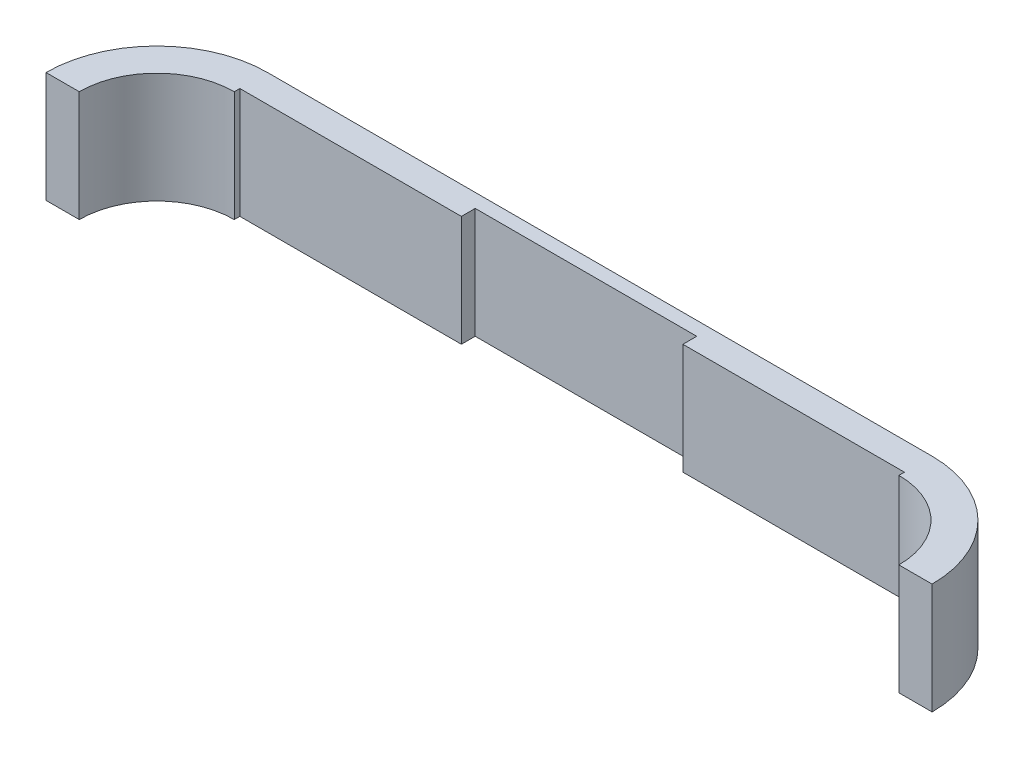
from build123d import *

# Parameters (mm, degrees)
BOSS_EXTRUDE3_DEPTH = 2000


with BuildPart() as part:
    # Sketch1 → Boss-Extrude3 (new body)
    with BuildSketch(Plane(origin=(0, 0, 0), x_dir=(1, 0, 0), z_dir=(0, 1, 0))):
        with BuildLine():
            Line((4435.152503865, -5133.846248201), (16435.152503865, -5133.846248201))
            ThreePointArc((16435.152503865, -5133.846248201), (17849.366066238, -5719.632685828), (18435.152503865, -7133.846248201))
            Line((18435.152503865, -7133.846248201), (17935.152503865, -7133.846248201))
            ThreePointArc((17935.152503865, -7133.846248201), (17495.812675645, -6073.186076421), (16435.152503865, -5633.846248201))
            Line((16435.152503865, -5633.846248201), (12435.152503865, -5633.846248201))
            Line((12435.152503865, -5633.846248201), (12435.152503865, -5383.846248201))
            Line((12435.152503865, -5383.846248201), (10435.152503865, -5383.846248201))
            Line((10435.152503865, -5383.846248201), (8435.152503865, -5383.846248201))
            Line((8435.152503865, -5383.846248201), (8435.152503865, -5633.846248201))
            Line((8435.152503865, -5633.846248201), (4435.152503865, -5633.846248201))
            ThreePointArc((4435.152503865, -5633.846248201), (3374.492332085, -6073.186076421), (2935.152503865, -7133.846248201))
            Line((2935.152503865, -7133.846248201), (2435.152503865, -7133.846248201))
            ThreePointArc((2435.152503865, -7133.846248201), (3020.938941492, -5719.632685828), (4435.152503865, -5133.846248201))
        make_face()
        with BuildLine():
            Line((4435.152503865, -5733.846248201), (4435.152503865, -5633.846248201))
            ThreePointArc((4435.152503865, -5633.846248201), (3374.492332085, -6073.186076421), (2935.152503865, -7133.846248201))
            Line((2935.152503865, -7133.846248201), (3035.152503865, -7133.846248201))
            ThreePointArc((3035.152503865, -7133.846248201), (3445.203010204, -6143.89675454), (4435.152503865, -5733.846248201))
        make_face()
        with BuildLine():
            ThreePointArc((16435.152503865, -5633.846248201), (17495.812675645, -6073.186076421), (17935.152503865, -7133.846248201))
            Line((17935.152503865, -7133.846248201), (17835.152503865, -7133.846248201))
            ThreePointArc((17835.152503865, -7133.846248201), (17425.101997526, -6143.89675454), (16435.152503865, -5733.846248201))
            Line((16435.152503865, -5733.846248201), (16435.152503865, -5633.846248201))
        make_face()
    extrude(amount=BOSS_EXTRUDE3_DEPTH)


solid = part.part
